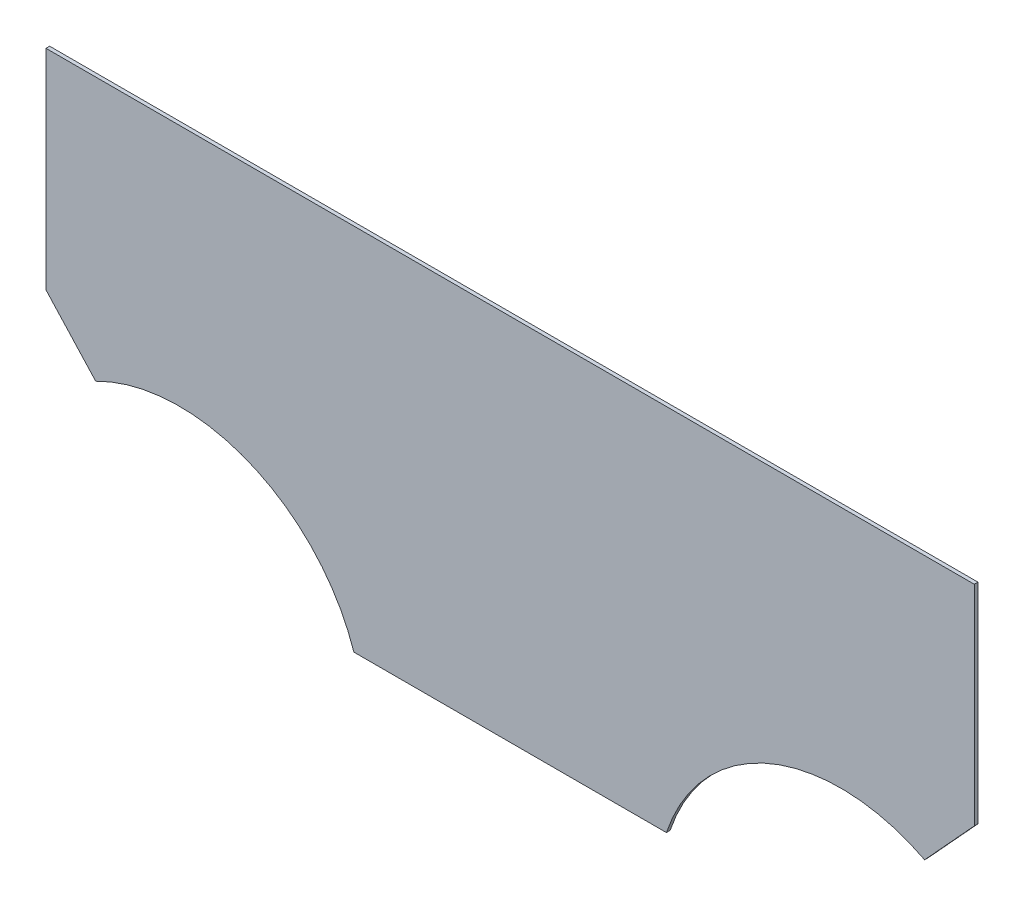
from build123d import *

# Parameters (mm, degrees)
BOSS_EXTRUDE1_DEPTH = 2


with BuildPart() as part:
    # Sketch1 → Boss-Extrude1 (new body)
    with BuildSketch(Plane(origin=(0, 0, 0), x_dir=(-1, 0, 0), z_dir=(0, 0, -1))):
        with BuildLine():
            Line((-26.412606162, -93.321181126), (0.613755662, -63.832611026))
            Line((0.613755662, -63.832611026), (0.613755662, 50))
            Line((0.613755662, 50), (-504.386244338, 50))
            Line((-504.386244338, 50), (-504.386244338, -63.832611026))
            Line((-504.386244338, -63.832611026), (-477.359882514, -93.321181126))
            ThreePointArc((-477.359882514, -93.321181126), (-393.934701104, -89.753038855), (-336.886244338, -150.72816586))
            Line((-336.886244338, -150.72816586), (-166.886244338, -150.72816586))
            ThreePointArc((-166.886244338, -150.72816586), (-109.837787572, -89.753038855), (-26.412606162, -93.321181126))
        make_face()
    extrude(amount=-BOSS_EXTRUDE1_DEPTH)


solid = part.part
